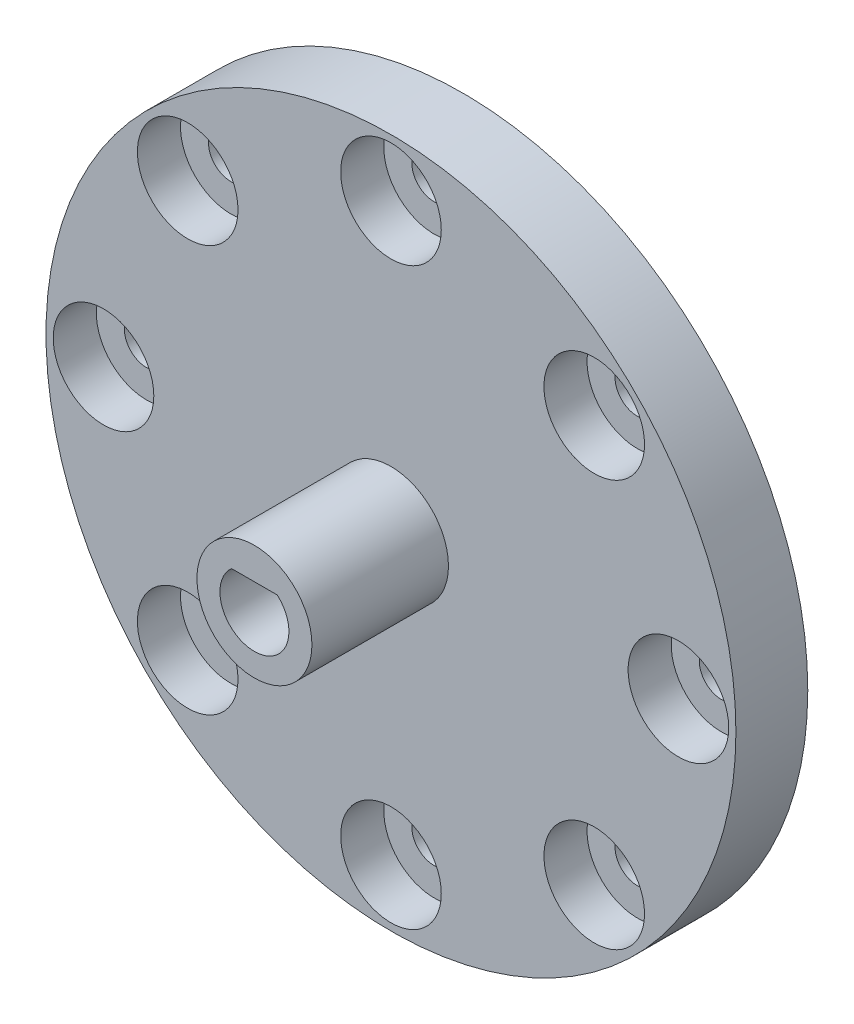
from build123d import *

# Parameters (mm, degrees)
SKETCH6_R           = 24
BOSS_EXTRUDE1_DEPTH = 5
SKETCH8_R           = 1.55
CUT_EXTRUDE6_DEPTH  = 5
SKETCH10_R          = 4
BOSS_EXTRUDE2_DEPTH = 9.5
SKETCH11_R          = 3.5
CUT_EXTRUDE8_DEPTH  = 3
CUT_EXTRUDE9_DEPTH  = 8


with BuildPart() as part:
    # Sketch6 → Boss-Extrude1 (new body)
    with BuildSketch(Plane.XY):
        Circle(SKETCH6_R)
    extrude(amount=BOSS_EXTRUDE1_DEPTH)

    # Sketch8 → Cut-Extrude6 (cut)
    with BuildSketch(Plane(origin=(0, 0, 0), x_dir=(-1, 0, 0), z_dir=(0, 0, -1))):
        with Locations((0, 20)):
            Circle(SKETCH8_R)
        with Locations((14.142135624, 14.142135624)):
            Circle(SKETCH8_R)
        with Locations((20, 0)):
            Circle(SKETCH8_R)
        with Locations((14.142135624, -14.142135624)):
            Circle(SKETCH8_R)
        with Locations((0, -20)):
            Circle(SKETCH8_R)
        with Locations((-14.142135624, -14.142135624)):
            Circle(SKETCH8_R)
        with Locations((-20, 0)):
            Circle(SKETCH8_R)
        with Locations((-14.142135624, 14.142135624)):
            Circle(SKETCH8_R)
    extrude(amount=-CUT_EXTRUDE6_DEPTH, mode=Mode.SUBTRACT)

    # Sketch10 → Boss-Extrude2 (add)
    with BuildSketch(Plane.XY.offset(5)):
        Circle(SKETCH10_R)
    extrude(amount=BOSS_EXTRUDE2_DEPTH)

    # Sketch11 → Cut-Extrude8 (cut)
    with BuildSketch(Plane.XY.offset(5)):
        with Locations((0, 20)):
            Circle(SKETCH11_R)
        with Locations((14.142135624, 14.142135624)):
            Circle(SKETCH11_R)
        with Locations((20, 0)):
            Circle(SKETCH11_R)
        with Locations((14.142135624, -14.142135624)):
            Circle(SKETCH11_R)
        with Locations((0, -20)):
            Circle(SKETCH11_R)
        with Locations((-14.142135624, -14.142135624)):
            Circle(SKETCH11_R)
        with Locations((-20, 0)):
            Circle(SKETCH11_R)
        with Locations((-14.142135624, 14.142135624)):
            Circle(SKETCH11_R)
    extrude(amount=-CUT_EXTRUDE8_DEPTH, mode=Mode.SUBTRACT)

    # Sketch12 → Cut-Extrude9 (cut)
    with BuildSketch(Plane.XY.offset(14.5)):
        with BuildLine():
            Line((-1.587450787, 1.8), (1.587450787, 1.8))
            ThreePointArc((1.587450787, 1.8), (0, -2.4), (-1.587450787, 1.8))
        make_face()
    extrude(amount=-CUT_EXTRUDE9_DEPTH, mode=Mode.SUBTRACT)


solid = part.part
